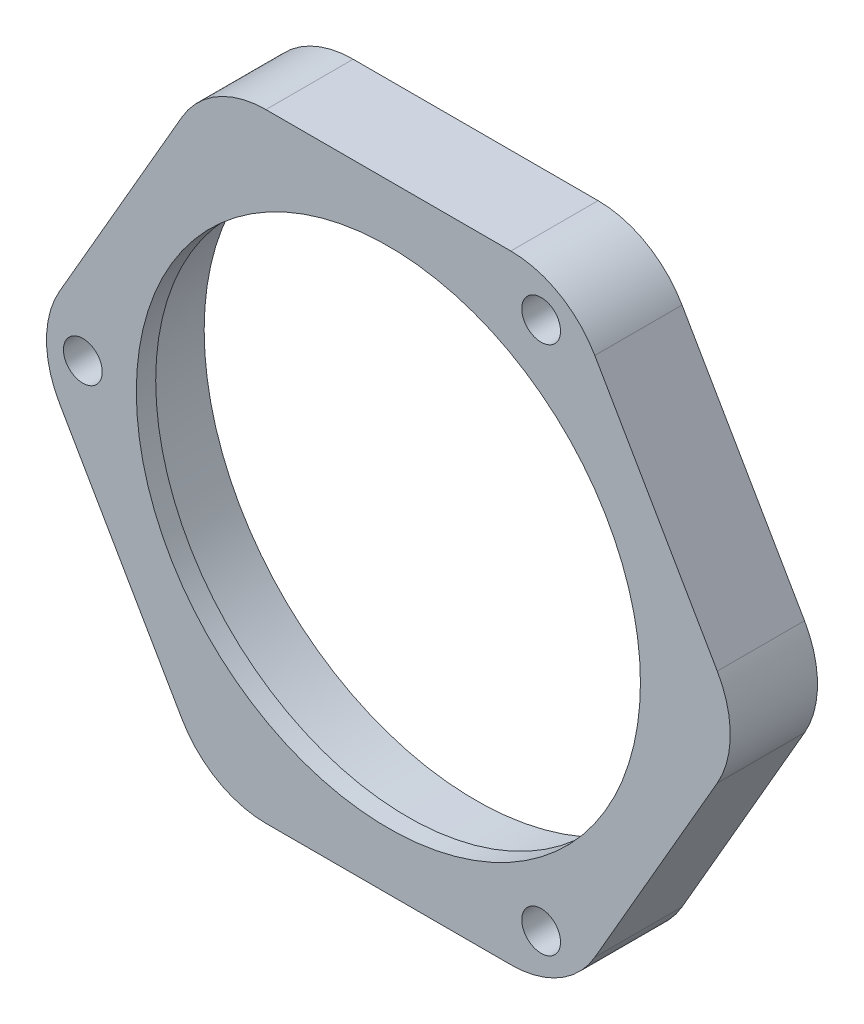
from build123d import *

# Parameters (mm, degrees)
SKETCH1_R           = 28
BOSS_EXTRUDE1_DEPTH = 9
FILLET1_R           = 10
SKETCH3_R           = 2
CUT_EXTRUDE1_DEPTH  = 49.383301757
CIRPATTERN1_COUNT   = 3
BOSS_EXTRUDE2_START = -2
SKETCH4_R           = 28
SKETCH4_R_2         = 26
BOSS_EXTRUDE2_DEPTH = 2


with BuildPart() as part:
    # Sketch1 → Boss-Extrude1 (new body)
    with BuildSketch(Plane.XY):
        Polygon((18.405926582, -31.88), (36.811853164, 0), (18.405926582, 31.88), (-18.405926582, 31.88), (-36.811853164, 0), (-18.405926582, -31.88), align=None)
        Circle(SKETCH1_R, mode=Mode.SUBTRACT)
    extrude(amount=BOSS_EXTRUDE1_DEPTH)

    # Fillet1
    fillet1_edges = [part.edges().sort_by_distance(p)[0] for p in [
        (-18.405926582, -31.88, 4.5),
        (-36.811853164, 0, 4.5),
        (-18.405926582, 31.88, 4.5),
        (18.405926582, 31.88, 4.5),
        (36.811853164, 0, 4.5),
        (18.405926582, -31.88, 4.5),
    ]]
    fillet(fillet1_edges, radius=FILLET1_R)

    # Sketch3 → Cut-Extrude1 (cut, through all)
    with BuildSketch(Plane.XY.offset(9)):
        with Locations((-31.51484778, 0)):
            Circle(SKETCH3_R)
    cut_extrude1 = extrude(amount=-CUT_EXTRUDE1_DEPTH, mode=Mode.SUBTRACT)

    # CirPattern1: Cut-Extrude1 ×3 about axis
    cirpattern1_axis = Axis((0, 0, 0), (0, 0, 1))
    for i in range(1, CIRPATTERN1_COUNT):
        add(cut_extrude1.rotate(cirpattern1_axis, i * 360 / CIRPATTERN1_COUNT), mode=Mode.SUBTRACT)

    # Sketch4 → Boss-Extrude2 (add)
    with BuildSketch(Plane.XY.offset(9).offset(BOSS_EXTRUDE2_START)):
        Circle(SKETCH4_R)
        Circle(SKETCH4_R_2, mode=Mode.SUBTRACT)
    extrude(amount=BOSS_EXTRUDE2_DEPTH)


solid = part.part
